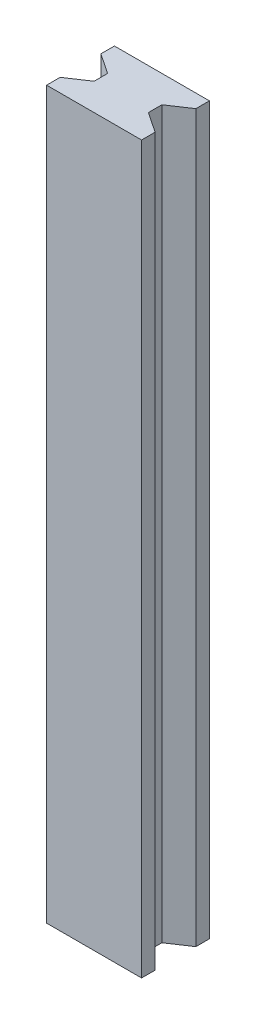
from build123d import *

# Parameters (mm, degrees)
SALIENTE_EXTRUIR1_DEPTH = 535


with BuildPart() as part:
    # Croquis2 → Saliente-Extruir1 (new body)
    with BuildSketch(Plane(origin=(0, 0, 0), x_dir=(1, 0, 0), z_dir=(0, 1, 0))):
        Polygon((-20, -5), (-35, -15), (-35, -25), (35, -25), (35, -15), (20, -5), (20, 5), (35, 15), (35, 25), (-35, 25), (-35, 15), (-20, 5), align=None)
    extrude(amount=SALIENTE_EXTRUIR1_DEPTH)


solid = part.part
